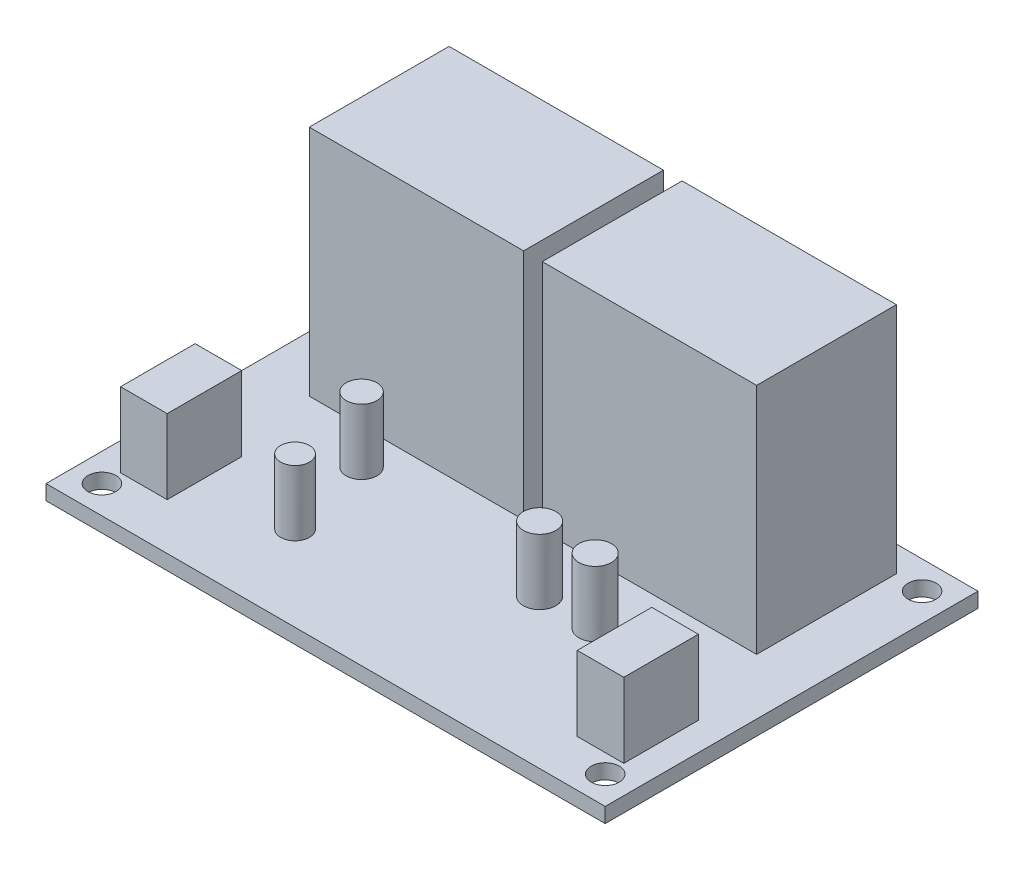
from build123d import *

# Parameters (mm, degrees)
SKETCH1_W           = 60
SKETCH1_H           = 40
BOSS_EXTRUDE1_DEPTH = 1.6
SKETCH2_W           = 23
SKETCH2_H           = 15
BOSS_EXTRUDE2_DEPTH = 25
SKETCH3_W           = 5
SKETCH3_H           = 8
BOSS_EXTRUDE3_DEPTH = 8
SKETCH4_R           = 1.651573935
SKETCH4_R_2         = 1.75
SKETCH4_R_3         = 1.546416864
BOSS_EXTRUDE4_DEPTH = 7
CUT_EXTRUDE1_REACH  = 45.875
SKETCH5_R           = 1.5


with BuildPart() as part:
    # Sketch1 → Boss-Extrude1 (new body)
    with BuildSketch(Plane(origin=(0, 0, 0), x_dir=(1, 0, 0), z_dir=(0, 1, 0))):
        Rectangle(SKETCH1_W, SKETCH1_H)
    extrude(amount=BOSS_EXTRUDE1_DEPTH)

    # Sketch2 → Boss-Extrude2 (add)
    with BuildSketch(Plane(origin=(0, 1.6, 0), x_dir=(1, 0, 0), z_dir=(0, 1, 0))):
        with Locations((-12.5, 9.746936541)):
            Rectangle(SKETCH2_W, SKETCH2_H)
        with Locations((12.5, 9.746936541)):
            Rectangle(SKETCH2_W, SKETCH2_H)
    extrude(amount=BOSS_EXTRUDE2_DEPTH)

    # Sketch3 → Boss-Extrude3 (add)
    with BuildSketch(Plane(origin=(0, 1.6, 0), x_dir=(1, 0, 0), z_dir=(0, 1, 0))):
        with Locations((-24.5, -11)):
            Rectangle(SKETCH3_W, SKETCH3_H)
        with Locations((24.5, -11)):
            Rectangle(SKETCH3_W, SKETCH3_H)
    extrude(amount=BOSS_EXTRUDE3_DEPTH)

    # Sketch4 → Boss-Extrude4 (add)
    with BuildSketch(Plane(origin=(0, 1.6, 0), x_dir=(1, 0, 0), z_dir=(0, 1, 0))):
        with Locations(Location((-14.609598895, -1.534440121, 0), (0, 0, 90))):
            Circle(SKETCH4_R)
        with Locations(Location((6.959010124, -3.998189047, 0), (0, 0, 90))):
            Circle(SKETCH4_R_2)
        with Locations(Location((-12.405191961, -10.87075184, 0), (0, 0, 90))):
            Circle(SKETCH4_R_3)
        with Locations(Location((12.923875945, -3.998189047, 0), (0, 0, 90))):
            Circle(SKETCH4_R_2)
    extrude(amount=BOSS_EXTRUDE4_DEPTH)

    # Sketch5 → Cut-Extrude1 (cut, up to next)
    with BuildSketch(Plane(origin=(0, 1.6, 0), x_dir=(1, 0, 0), z_dir=(0, 1, 0)), mode=Mode.PRIVATE) as cut_extrude1_sk1:
        with Locations(Location((-27, 17, 0), (0, 0, 270))):
            Circle(SKETCH5_R)
    cut_extrude1_tool1 = extrude(cut_extrude1_sk1.sketch, amount=-CUT_EXTRUDE1_REACH, mode=Mode.PRIVATE) & part.part
    # Sketch5 → Cut-Extrude1 (cut, up to next)
    with BuildSketch(Plane(origin=(0, 1.6, 0), x_dir=(1, 0, 0), z_dir=(0, 1, 0)), mode=Mode.PRIVATE) as cut_extrude1_sk2:
        with Locations(Location((-27, -17, 0), (0, 0, 270))):
            Circle(SKETCH5_R)
    cut_extrude1_tool2 = extrude(cut_extrude1_sk2.sketch, amount=-CUT_EXTRUDE1_REACH, mode=Mode.PRIVATE) & part.part
    # Sketch5 → Cut-Extrude1 (cut, up to next)
    with BuildSketch(Plane(origin=(0, 1.6, 0), x_dir=(1, 0, 0), z_dir=(0, 1, 0)), mode=Mode.PRIVATE) as cut_extrude1_sk3:
        with Locations(Location((27, -17, 0), (0, 0, 270))):
            Circle(SKETCH5_R)
    cut_extrude1_tool3 = extrude(cut_extrude1_sk3.sketch, amount=-CUT_EXTRUDE1_REACH, mode=Mode.PRIVATE) & part.part
    # Sketch5 → Cut-Extrude1 (cut, up to next)
    with BuildSketch(Plane(origin=(0, 1.6, 0), x_dir=(1, 0, 0), z_dir=(0, 1, 0)), mode=Mode.PRIVATE) as cut_extrude1_sk4:
        with Locations(Location((27, 17, 0), (0, 0, 270))):
            Circle(SKETCH5_R)
    cut_extrude1_tool4 = extrude(cut_extrude1_sk4.sketch, amount=-CUT_EXTRUDE1_REACH, mode=Mode.PRIVATE) & part.part
    add(cut_extrude1_tool1.solids().sort_by_distance((-27, 1.6, -17))[0], mode=Mode.SUBTRACT)
    add(cut_extrude1_tool2.solids().sort_by_distance((-27, 1.6, 17))[0], mode=Mode.SUBTRACT)
    add(cut_extrude1_tool3.solids().sort_by_distance((27, 1.6, 17))[0], mode=Mode.SUBTRACT)
    add(cut_extrude1_tool4.solids().sort_by_distance((27, 1.6, -17))[0], mode=Mode.SUBTRACT)


solid = part.part
